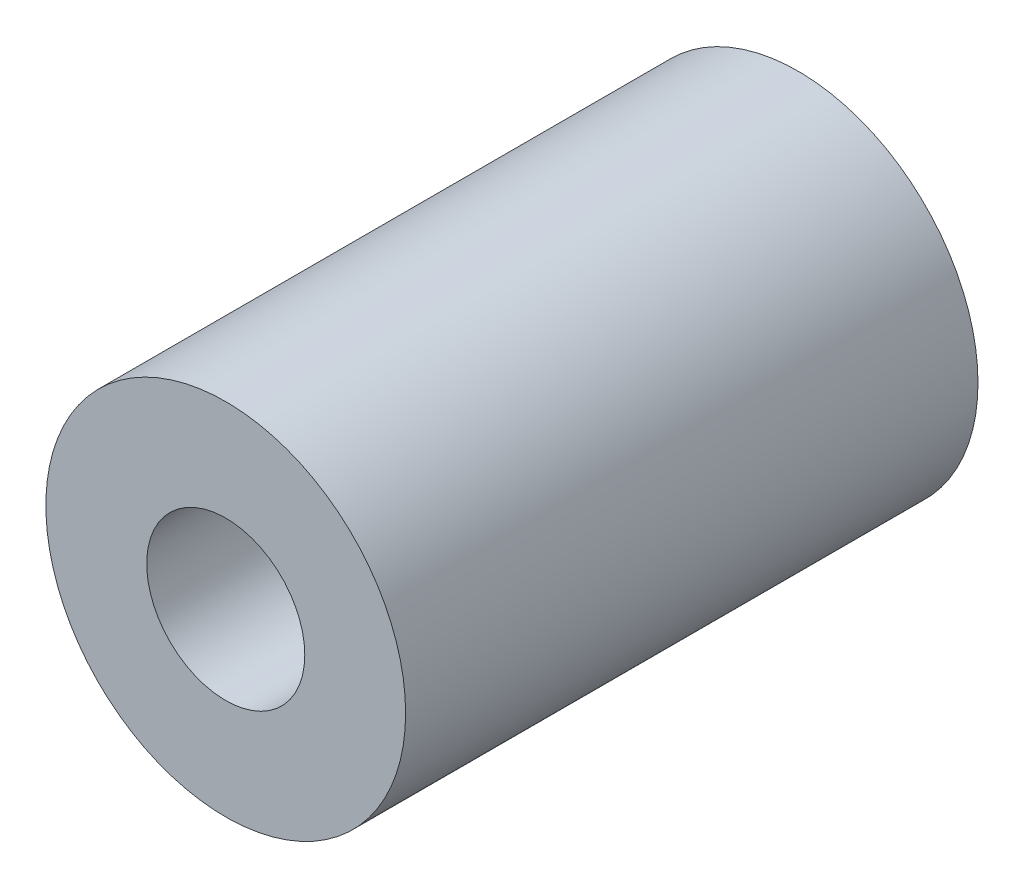
from build123d import *

# Parameters (mm, degrees)
SKETCH_1_R      = 33
SKETCH_1_R_2    = 14.5
EXTRUDE_1_DEPTH = 52.5


with BuildPart() as part:
    # 草图1 → 凸台-拉伸1 (new, symmetric)
    with BuildSketch(Plane.XY):
        Circle(SKETCH_1_R)
        Circle(SKETCH_1_R_2, mode=Mode.SUBTRACT)
    extrude(amount=EXTRUDE_1_DEPTH, both=True)


solid = part.part
